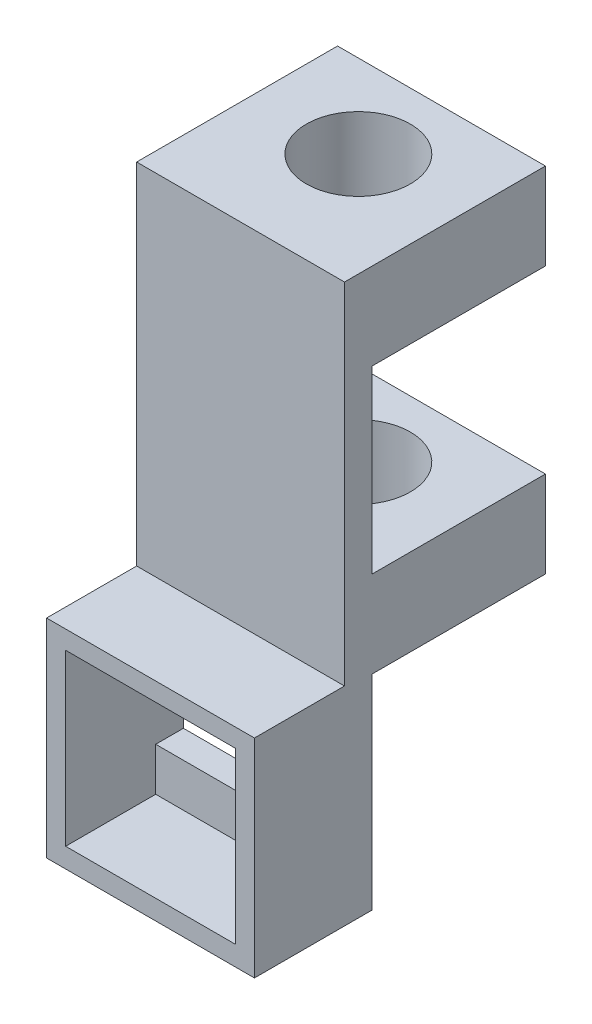
from build123d import *

# Parameters (mm, degrees)
SKETCH1_W           = 7.62
SKETCH1_H           = 20.447
BOSS_EXTRUDE1_DEPTH = 1.016
SKETCH2_W           = 7.62
SKETCH2_H           = 3.175
BOSS_EXTRUDE2_DEPTH = 6.35
SKETCH3_R           = 1.905
CUT_EXTRUDE1_DEPTH  = 22.746687311
SKETCH5_W           = 7.62
SKETCH5_H           = 7.62
SKETCH5_W_2         = 6.223
SKETCH5_H_2         = 6.223
BOSS_EXTRUDE3_DEPTH = 3.302
CUT_EXTRUDE3_DEPTH  = 14.16411821


with BuildPart() as part:
    # Sketch1 → Boss-Extrude1 (new body)
    with BuildSketch(Plane.XY):
        Rectangle(SKETCH1_W, SKETCH1_H)
    extrude(amount=BOSS_EXTRUDE1_DEPTH)

    # Sketch2 → Boss-Extrude2 (add)
    with BuildSketch(Plane(origin=(0, 0, 0), x_dir=(-1, 0, 0), z_dir=(0, 0, -1))):
        with Locations((0, 8.636)):
            Rectangle(SKETCH2_W, SKETCH2_H)
        with Locations((0, -1.143)):
            Rectangle(SKETCH2_W, SKETCH2_H)
    extrude(amount=BOSS_EXTRUDE2_DEPTH)

    # Sketch3 → Cut-Extrude1 (cut, through all)
    with BuildSketch(Plane(origin=(0, 10.2235, 0), x_dir=(1, 0, 0), z_dir=(0, 1, 0))):
        with Locations(Location((0, 3.302, 0), (0, 0, 180))):
            Circle(SKETCH3_R)
    extrude(amount=-CUT_EXTRUDE1_DEPTH, mode=Mode.SUBTRACT)

    # Sketch5 → Boss-Extrude3 (add)
    with BuildSketch(Plane.XY.offset(1.016)):
        with Locations((0, -6.4135)):
            Rectangle(SKETCH5_W, SKETCH5_H)
        with Locations((0, -6.39034895)):
            Rectangle(SKETCH5_W_2, SKETCH5_H_2, mode=Mode.SUBTRACT)
    extrude(amount=BOSS_EXTRUDE3_DEPTH)

    # Sketch7 → Cut-Extrude3 (cut, through all)
    with BuildSketch(Plane.XY.offset(1.016)):
        Polygon((-3.1115, -7.91434895), (-1.524, -7.91434895), (1.524, -7.91434895), (3.1115, -7.91434895), (3.1115, -4.86634895), (1.524, -4.86634895), (-1.524, -4.86634895), (-3.1115, -4.86634895), align=None)
    extrude(amount=-CUT_EXTRUDE3_DEPTH, mode=Mode.SUBTRACT)


solid = part.part
